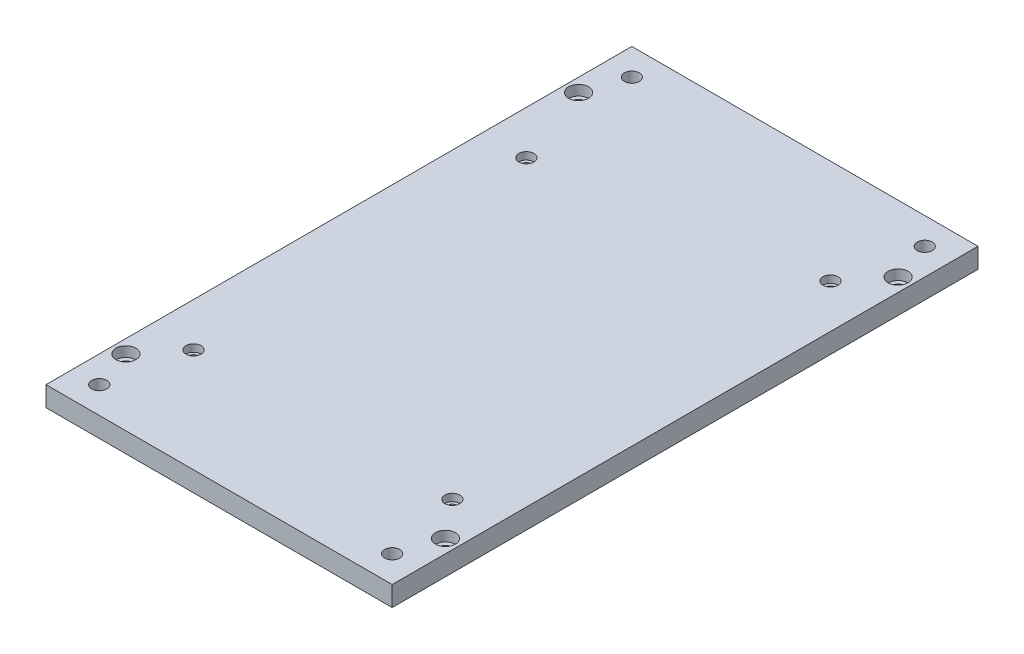
from build123d import *

# Parameters (mm, degrees)
SKETCH1_W                                       = 165.1
SKETCH1_H                                       = 279.4
BOSS_EXTRUDE1_DEPTH                             = 9.525
F_1_4_CLEARANCE_HOLE1_D                         = 7.14248
CBORE_FOR_10_SOCKET_HEAD_CAP_SCREW1_D           = 5.6134
CBORE_FOR_10_SOCKET_HEAD_CAP_SCREW1_CBORE_D     = 9.525
CBORE_FOR_10_SOCKET_HEAD_CAP_SCREW1_CBORE_DEPTH = 4.826
CBORE_FOR_6_SOCKET_HEAD_CAP_SCREW1_D            = 4.3053
CBORE_FOR_6_SOCKET_HEAD_CAP_SCREW1_CBORE_D      = 7.14502
CBORE_FOR_6_SOCKET_HEAD_CAP_SCREW1_CBORE_DEPTH  = 3.5052


with BuildPart() as part:
    # Sketch1 → Boss-Extrude1 (new body)
    with BuildSketch(Plane(origin=(0, 0, 0), x_dir=(1, 0, 0), z_dir=(0, 1, 0))):
        with Locations((82.55, 139.7)):
            Rectangle(SKETCH1_W, SKETCH1_H)
    extrude(amount=BOSS_EXTRUDE1_DEPTH)

    # 1/4 Clearance Hole1 (through all)
    with Locations(Plane(origin=(0, 9.525, 0), x_dir=(1, 0, 0), z_dir=(0, 1, 0))):
        with Locations((152.4, 12.7), (12.7, 12.7), (12.7, 266.7), (152.4, 266.7)):
            Hole(F_1_4_CLEARANCE_HOLE1_D / 2)

    # CBORE for #10 Socket Head Cap Screw1 (through all)
    with Locations(Plane(origin=(0, 9.525, 0), x_dir=(1, 0, 0), z_dir=(0, 1, 0))):
        with Locations((6.35, 247.65), (6.35, 31.75), (158.75, 31.75), (158.75, 247.65)):
            CounterBoreHole(CBORE_FOR_10_SOCKET_HEAD_CAP_SCREW1_D / 2, CBORE_FOR_10_SOCKET_HEAD_CAP_SCREW1_CBORE_D / 2, CBORE_FOR_10_SOCKET_HEAD_CAP_SCREW1_CBORE_DEPTH)

    # CBORE for #6 Socket Head Cap Screw1 (through all)
    with Locations(Plane(origin=(0, 9.525, 0), x_dir=(1, 0, 0), z_dir=(0, 1, 0))):
        with Locations((144.272, 229.87), (144.272, 49.53), (20.828, 49.53), (20.828, 208.28)):
            CounterBoreHole(CBORE_FOR_6_SOCKET_HEAD_CAP_SCREW1_D / 2, CBORE_FOR_6_SOCKET_HEAD_CAP_SCREW1_CBORE_D / 2, CBORE_FOR_6_SOCKET_HEAD_CAP_SCREW1_CBORE_DEPTH)


solid = part.part
